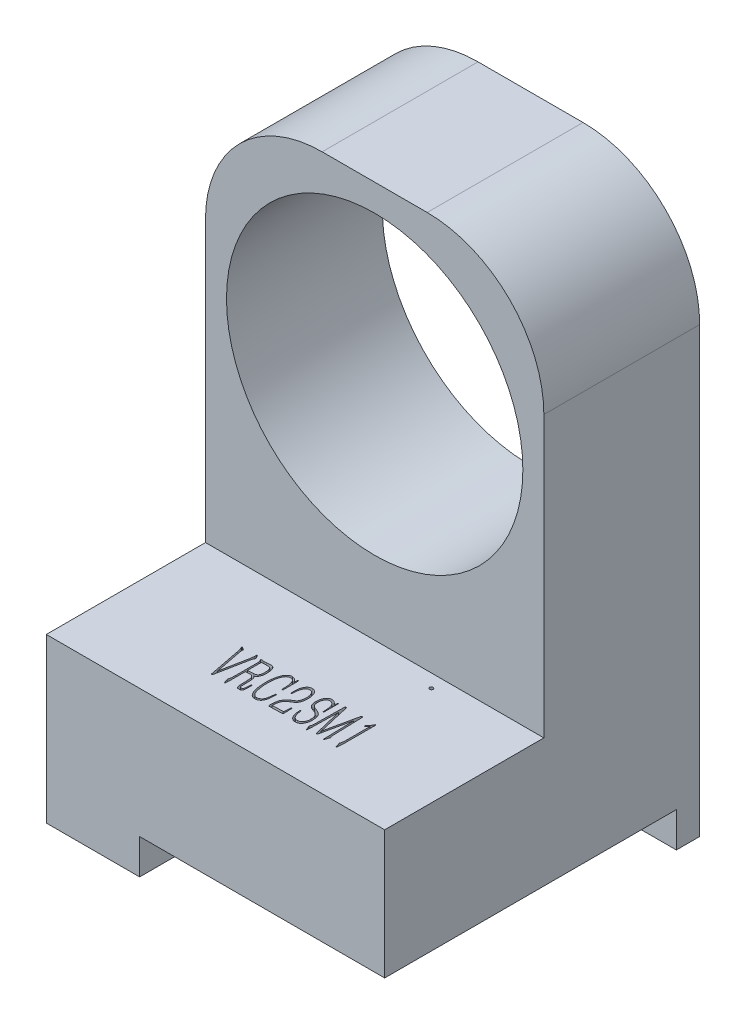
from build123d import *

# Parameters (mm, degrees)
SKETCH_1_W          = 29
SKETCH_1_H          = 29
EXTRUDE_1_DEPTH     = 5
SKETCH_2_W          = 25
SKETCH_2_H          = 25
CUT_EXTRUDE_1_DEPTH = 3
SKETCH_4_W          = 29
SKETCH_4_H          = 29
EXTRUDE_2_DEPTH     = 43
HOLE_WIZARD_M27_1_D = 25.4
CUT_EXTRUDE_START   = -15.643
SKETCH_10_R         = 18
CUT_EXTRUDE_2_DEPTH = 15.643
SKETCH_11_R         = 1
CUT_EXTRUDE_3_DEPTH = 3
CUT_EXTRUDE_4_DEPTH = 15.643
SKETCH_13_W         = 29
SKETCH_13_H         = 5
EXTRUDE_3_DEPTH     = 6
SKETCH_14_W         = 6
SKETCH_14_H         = 29
CUT_EXTRUDE_5_DEPTH = 50.794578018
SKETCH_15_W         = 29
SKETCH_15_H         = 2
CUT_EXTRUDE_6_DEPTH = 55.171025466
FILLET_1_R          = 10
CUT_EXTRUDE_7_REACH = 60.764
CUT_EXTRUDE_8_DEPTH = 0.5


with BuildPart() as part:
    # 草图1 → 凸台-拉伸1 (new body)
    with BuildSketch(Plane(origin=(0, 0, 0), x_dir=(1, 0, 0), z_dir=(0, 1, 0))):
        Rectangle(SKETCH_1_W, SKETCH_1_H)
    extrude(amount=EXTRUDE_1_DEPTH)

    # 草图2 → 切除-拉伸1 (cut)
    with BuildSketch(Plane.XZ):
        Rectangle(SKETCH_2_W, SKETCH_2_H)
    extrude(amount=-CUT_EXTRUDE_1_DEPTH, mode=Mode.SUBTRACT)

    # 草图4 → 凸台-拉伸2 (add)
    with BuildSketch(Plane(origin=(0, 5, 0), x_dir=(1, 0, 0), z_dir=(0, 1, 0))):
        with Locations((-6, 0)):
            Rectangle(SKETCH_4_W, SKETCH_4_H)
    extrude(amount=EXTRUDE_2_DEPTH)

    # 草图7 → M4 螺纹孔1 (revolve, cut)
    with BuildSketch(Plane(origin=(0, 3, 0), x_dir=(0, 0, -1), z_dir=(1, 0, 0))):
        Polygon((0, 0), (0, 11.091420021), (1.65, 10.1), (1.65, 0), align=None)
    revolve(axis=Axis((0, -3.35, 0), (0, 1, 0)), mode=Mode.SUBTRACT)

    # M27 螺纹孔1 (through all)
    with Locations(Plane(origin=(-6, 33, 14.5), x_dir=(1, 0, 0), z_dir=(0, 0, 1))):
        with Locations((0, 0)):
            Hole(HOLE_WIZARD_M27_1_D / 2)

    # 草图10 → 切除-拉伸2 (cut)
    with BuildSketch(Plane.XY.offset(14.5).offset(CUT_EXTRUDE_START)):
        with Locations((-6, 33)):
            Circle(SKETCH_10_R)
    extrude(amount=CUT_EXTRUDE_2_DEPTH, mode=Mode.SUBTRACT)

    # 草图11 → 切除-拉伸3 (cut)
    with BuildSketch(Plane(origin=(0, 0, 0), x_dir=(-1, 0, 0), z_dir=(0, -1, 0))):
        with Locations((12.5, 12.5)):
            Circle(SKETCH_11_R)
    extrude(amount=-CUT_EXTRUDE_3_DEPTH, mode=Mode.SUBTRACT)

    # 草图12 → 切除-拉伸4 (cut)
    with BuildSketch(Plane.XY.offset(14.5).offset(CUT_EXTRUDE_START)):
        with BuildLine():
            Line((-20.5, 48), (-20.5, 43.665364504))
            ThreePointArc((-20.5, 43.665364504), (-18.415569073, 46.032791128), (-15.949874371, 48))
            Line((-15.949874371, 48), (-20.5, 48))
        make_face()
        with BuildLine():
            Line((8.5, 48), (3.949874371, 48))
            ThreePointArc((3.949874371, 48), (6.415569073, 46.032791128), (8.5, 43.665364504))
            Line((8.5, 43.665364504), (8.5, 48))
        make_face()
    extrude(amount=CUT_EXTRUDE_4_DEPTH, mode=Mode.SUBTRACT)

    # 草图13 → 凸台-拉伸3 (add)
    with BuildSketch(Plane.ZY.offset(14.5)):
        with Locations((0, 2.5)):
            Rectangle(SKETCH_13_W, SKETCH_13_H)
    extrude(amount=EXTRUDE_3_DEPTH)

    # 草图14 → 切除-拉伸5 (cut, through all)
    with BuildSketch(Plane(origin=(0, 5, 0), x_dir=(1, 0, 0), z_dir=(0, 1, 0))):
        with Locations((11.5, 0)):
            Rectangle(SKETCH_14_W, SKETCH_14_H)
    extrude(amount=-CUT_EXTRUDE_5_DEPTH, mode=Mode.SUBTRACT)

    # 草图15 → 切除-拉伸6 (cut, through all)
    with BuildSketch(Plane.XZ):
        with Locations((-6, 13.5)):
            Rectangle(SKETCH_15_W, SKETCH_15_H)
    extrude(amount=-CUT_EXTRUDE_6_DEPTH, mode=Mode.SUBTRACT)

    # 圆角1
    fillet_1_edges = [part.edges().sort_by_distance(p)[0] for p in [
        (-20.5, 48, -7.8215),
        (8.5, 48, -7.8215),
    ]]
    fillet(fillet_1_edges, radius=FILLET_1_R)

    # 切除-拉伸7: up to this face of the body (flat: up to its plane)
    cut_extrude_7_end = Plane(part.part.faces().sort_by_distance((-6, 47.560682347, -1.143))[0])
    # 草图16 → 切除-拉伸7 (cut, up to the picked face)
    with BuildSketch(Plane.XY.offset(12.5), mode=Mode.PRIVATE) as cut_extrude_7_sk1:
        with BuildLine():
            Line((-20.5, 22.334635496), (-20.5, 14))
            Line((-20.5, 14), (8.5, 14))
            Line((8.5, 14), (8.5, 22.334635496))
            ThreePointArc((8.5, 22.334635496), (-6, 15), (-20.5, 22.334635496))
        make_face()
    cut_extrude_7_tool1 = split(extrude(cut_extrude_7_sk1.sketch, amount=-CUT_EXTRUDE_7_REACH, mode=Mode.PRIVATE), bisect_by=cut_extrude_7_end, keep=Keep.BOTH, mode=Mode.PRIVATE)
    add(cut_extrude_7_tool1.solids().sort_by(Axis((-20.198261, 18.167318, 12.5), (0, 0, -1)))[0], mode=Mode.SUBTRACT)

    # 草图17 → 切除-拉伸8 (cut)
    # profile 1 of 7: a face of its own
    with BuildSketch(Plane(origin=(0, 14, 0), x_dir=(1, 0, 0), z_dir=(0, 1, 0))):
        with BuildLine():
            Line((-9.956277984, -5.026142166), (-9.901089405, -5.001531043))
            Line((-9.901089405, -5.001531043), (-9.725082586, -5.313271934))
            add(Edge.make_bspline(
                [(-9.725082586, -5.313271934), (-9.734000407, -5.328453469), (-9.749914638, -5.355545566), (-9.773762803, -5.395146232), (-9.7961015, -5.439650448), (-9.815796245, -5.484696301), (-9.833181085, -5.531435513), (-9.844275475, -5.576643473), (-9.856764948, -5.628652416), (-9.862822278, -5.666225736), (-9.8660372, -5.686167736)],
                knots=[0, 0, 0, 0, 1.050845495, 1.875278674, 2.7577401, 4.020108455, 4.808513078, 5.729779683, 6.795082978, 8, 8, 8, 8], degree=3))
            Line((-9.8660372, -5.686167736), (-10.394057656, -8.368780137))
            Line((-10.394057656, -8.368780137), (-10.485044231, -8.374000679))
            Line((-10.485044231, -8.374000679), (-11.028726311, -5.580265328))
            add(Edge.make_bspline(
                [(-11.028726311, -5.580265328), (-11.031348337, -5.568304541), (-11.037057212, -5.542262604), (-11.048881015, -5.500783794), (-11.060973702, -5.452757525), (-11.076500746, -5.401535328), (-11.091288451, -5.350460428), (-11.105533834, -5.304820389), (-11.117189969, -5.26602297), (-11.131700033, -5.226255636), (-11.147457374, -5.185043301), (-11.162728404, -5.15579959), (-11.169680924, -5.142485656)],
                knots=[0, 0, 0, 0, 0.796855161, 1.734973822, 2.806513648, 4.020139396, 5.218239302, 6.267555842, 7.132481218, 7.85415497, 9.023050118, 10, 10, 10, 10], degree=3))
            Line((-11.169680924, -5.142485656), (-11.20473313, -5.076855995))
            Line((-11.20473313, -5.076855995), (-11.169680924, -5.016446875))
            Line((-11.169680924, -5.016446875), (-10.90268753, -5.207369526))
            add(Edge.make_bspline(
                [(-10.90268753, -5.207369526), (-10.906991348, -5.22644319), (-10.91509647, -5.26236348), (-10.921983084, -5.316827896), (-10.920284024, -5.374599758), (-10.913547461, -5.440096261), (-10.900610446, -5.51487532), (-10.892184583, -5.567578746), (-10.887771698, -5.59518116)],
                knots=[0, 0, 0, 0, 0.898331485, 1.691773928, 2.514283857, 3.547449524, 4.715523432, 6, 6, 6, 6], degree=3))
            Line((-10.887771698, -5.59518116), (-10.439550944, -7.875811887))
            Line((-10.439550944, -7.875811887), (-9.991330189, -5.580265328))
            add(Edge.make_bspline(
                [(-9.991330189, -5.580265328), (-9.986419053, -5.551207687), (-9.975823924, -5.488519647), (-9.965685068, -5.408302067), (-9.957837899, -5.342404413), (-9.953447855, -5.29712201), (-9.949745173, -5.258089836), (-9.947569449, -5.233970153), (-9.946582693, -5.22303115)],
                knots=[0, 0, 0, 0, 1.472770085, 3.177307748, 4.040376616, 4.789595524, 5.451045058, 6, 6, 6, 6], degree=3))
            add(Edge.make_bspline(
                [(-9.946582693, -5.22303115), (-9.946560517, -5.203132782), (-9.946517229, -5.164291579), (-9.949569064, -5.125571448), (-9.951057443, -5.106687659)],
                knots=[0, 0, 0, 0, 1.024601013, 2, 2, 2, 2], degree=3))
            Line((-9.951057443, -5.106687659), (-9.956277984, -5.026142166))
        make_face()
    # profile 2 of 7: a face of its own
    with BuildSketch(Plane(origin=(0, 14, 0), x_dir=(1, 0, 0), z_dir=(0, 1, 0))):
        with BuildLine():
            add(Edge.make_bspline(
                [(-8.492289064, -6.68254532), (-8.47735489, -6.70415802), (-8.450270488, -6.743354499), (-8.411628235, -6.799869907), (-8.381044203, -6.86021635), (-8.361771496, -6.93405542), (-8.346633561, -7.023190505), (-8.335530613, -7.126843401), (-8.326737642, -7.241494315), (-8.326234901, -7.32117246), (-8.325977536, -7.361961471)],
                knots=[0, 0, 0, 0, 0.881232765, 1.598190978, 2.295533752, 3.137383339, 4.144986829, 5.328248715, 6.632271209, 8, 8, 8, 8], degree=3))
            Line((-8.325977536, -7.361961471), (-8.311061704, -7.830318599))
            add(Edge.make_bspline(
                [(-8.311061704, -7.830318599), (-8.310573866, -7.856397367), (-8.309630415, -7.906832166), (-8.308160019, -7.977942558), (-8.300234618, -8.036537002), (-8.290532609, -8.079136905), (-8.268658458, -8.1011317), (-8.243596893, -8.111179658), (-8.209850752, -8.116224226), (-8.184297485, -8.11701129), (-8.170107091, -8.117448367)],
                knots=[0, 0, 0, 0, 1.650852431, 3.192651296, 4.477622576, 5.427192863, 5.849578153, 6.384274066, 7.102745334, 8, 8, 8, 8], degree=3))
            add(Edge.make_bspline(
                [(-8.170107091, -8.117448367), (-8.155866098, -8.118128617), (-8.129222668, -8.119401295), (-8.090418335, -8.106694055), (-8.058791589, -8.078107913), (-8.036924954, -8.034245311), (-8.020423485, -7.979952554), (-8.011202603, -7.914238775), (-8.002133471, -7.83689005), (-7.996944484, -7.780617488), (-7.994100272, -7.749773106)],
                knots=[0, 0, 0, 0, 0.741895998, 1.388010978, 2.079699508, 2.912679041, 3.92113713, 5.042206699, 6.378760387, 8, 8, 8, 8], degree=3))
            Line((-7.994100272, -7.749773106), (-7.968743358, -7.462643338))
            Line((-7.968743358, -7.462643338), (-7.903113697, -7.462643338))
            Line((-7.903113697, -7.462643338), (-7.903113697, -7.815402767))
            add(Edge.make_bspline(
                [(-7.903113697, -7.815402767), (-7.903401351, -7.848720442), (-7.903931789, -7.910158723), (-7.907586021, -7.994228985), (-7.91281996, -8.062563547), (-7.921670311, -8.116510114), (-7.933782373, -8.160390764), (-7.950989949, -8.196700853), (-7.971977802, -8.22859635), (-7.998437421, -8.253422097), (-8.026906868, -8.27409516), (-8.058093797, -8.288964083), (-8.090907169, -8.29973746), (-8.135103882, -8.305623202), (-8.185301116, -8.307007121), (-8.22381099, -8.304854645), (-8.240957293, -8.303896268)],
                knots=[0, 0, 0, 0, 1.955595562, 3.606146949, 4.93917426, 5.975540879, 6.81139212, 7.601269519, 8.32576276, 9.0378047, 9.718034635, 10.383709129, 11.057491241, 11.736467872, 12.992175141, 14, 14, 14, 14], degree=3))
            add(Edge.make_bspline(
                [(-8.240957293, -8.303896268), (-8.252980099, -8.302883719), (-8.275930229, -8.300950883), (-8.307682404, -8.290586819), (-8.335929964, -8.277338135), (-8.360509606, -8.259031455), (-8.381125039, -8.23501505), (-8.398131623, -8.205215036), (-8.41293361, -8.16985683), (-8.425789532, -8.127685867), (-8.436452029, -8.076334256), (-8.442893951, -8.013629091), (-8.449222445, -7.938810781), (-8.451038293, -7.884777881), (-8.452016318, -7.855675514)],
                knots=[0, 0, 0, 0, 0.785514098, 1.499454538, 2.167605402, 2.81714562, 3.484704239, 4.219933844, 5.049370252, 5.984178009, 7.095655963, 8.469322192, 10.098360771, 12, 12, 12, 12], degree=3))
            Line((-8.452016318, -7.855675514), (-8.457236859, -7.614039034))
            Line((-8.457236859, -7.614039034), (-8.4624574, -7.367182013))
            add(Edge.make_bspline(
                [(-8.4624574, -7.367182013), (-8.464303129, -7.334853597), (-8.468224818, -7.266164239), (-8.47710931, -7.162227313), (-8.486754067, -7.061487594), (-8.504343283, -6.972946923), (-8.530354546, -6.898152975), (-8.564700092, -6.834444441), (-8.607070143, -6.781718909), (-8.660159141, -6.745220114), (-8.722196092, -6.724842025), (-8.792892849, -6.713704311), (-8.87361971, -6.709544745), (-8.930571349, -6.71188627), (-8.960646192, -6.713122775)],
                knots=[0, 0, 0, 0, 1.186982176, 2.522024164, 3.82431485, 4.894934829, 5.823070192, 6.716229133, 7.537699214, 8.278355097, 9.042196562, 9.911176558, 10.896940655, 12, 12, 12, 12], degree=3))
            Line((-8.960646192, -6.713122775), (-9.207503213, -6.733259149))
            Line((-9.207503213, -6.733259149), (-9.207503213, -7.921305175))
            add(Edge.make_bspline(
                [(-9.207503213, -7.921305175), (-9.209688999, -7.960338604), (-9.213671249, -8.031453032), (-9.219723614, -8.127136469), (-9.224367813, -8.201473606), (-9.227915562, -8.269352307), (-9.232578451, -8.334363624), (-9.239499297, -8.389032224), (-9.24712299, -8.424586261), (-9.250805349, -8.439509904), (-9.255745086, -8.451446516), (-9.260827539, -8.449894802), (-9.262691792, -8.449325631)],
                knots=[0, 0, 0, 0, 2.178702561, 3.969346042, 5.343442504, 6.32866056, 7.759955515, 8.962971945, 9.43033784, 9.732921223, 9.902035012, 10, 10, 10, 10], degree=3))
            add(Edge.make_bspline(
                [(-9.262691792, -8.449325631), (-9.264950863, -8.448649358), (-9.2705181, -8.446982757), (-9.281530387, -8.440737251), (-9.293487006, -8.42160199), (-9.306685392, -8.393511038), (-9.31932358, -8.360890893), (-9.321961243, -8.3382779), (-9.323100912, -8.328507391)],
                knots=[0, 0, 0, 0, 0.301236197, 0.742364128, 1.580669581, 3.100179862, 4.747060191, 6, 6, 6, 6], degree=3))
            Line((-9.323100912, -8.328507391), (-9.383510032, -8.147280031))
            add(Edge.make_bspline(
                [(-9.383510032, -8.147280031), (-9.389192844, -8.130870654), (-9.399169589, -8.102062352), (-9.412421479, -8.065019957), (-9.419451041, -8.039749535), (-9.422996434, -8.019387295), (-9.414385921, -7.998804482), (-9.402002176, -7.971261147), (-9.387844441, -7.933552178), (-9.375693692, -7.888272956), (-9.365079086, -7.842272205), (-9.358157122, -7.803401432), (-9.355607432, -7.767175419), (-9.352241806, -7.726461037), (-9.350554759, -7.671216371), (-9.348566192, -7.607076413), (-9.34613535, -7.544690483), (-9.345406587, -7.494690215), (-9.343070544, -7.462658945), (-9.343198195, -7.447231261), (-9.343237285, -7.442506965)],
                knots=[0, 0, 0, 0, 1.301962309, 2.285725083, 2.940890519, 3.278257869, 3.802826989, 4.553745501, 5.567560366, 6.806006901, 8.066807115, 9.104973239, 9.759343731, 10.786589445, 12.166193442, 13.899498157, 15.595566675, 16.84419832, 17.646068083, 18, 18, 18, 18], degree=3))
            Line((-9.343237285, -7.442506965), (-9.343237285, -5.47436292))
            add(Edge.make_bspline(
                [(-9.343237285, -5.47436292), (-9.343580839, -5.459156244), (-9.344237895, -5.430073046), (-9.351562986, -5.388731264), (-9.360785227, -5.35091417), (-9.372615556, -5.329001832), (-9.37828949, -5.318492475)],
                knots=[0, 0, 0, 0, 1.127954724, 2.157245254, 3.116197974, 4, 4, 4, 4], degree=3))
            Line((-9.37828949, -5.318492475), (-9.429003319, -5.243167523))
            add(Edge.make_bspline(
                [(-9.429003319, -5.243167523), (-9.434099526, -5.234065228), (-9.443268806, -5.217688048), (-9.453913863, -5.194549491), (-9.457374421, -5.175944479), (-9.458591612, -5.160181386), (-9.447143444, -5.148757909), (-9.427818093, -5.146293851), (-9.401019396, -5.146313566), (-9.380508506, -5.150025038), (-9.3685942, -5.152180947)],
                knots=[0, 0, 0, 0, 1.380566717, 2.483966017, 3.320820912, 3.912566683, 4.446905125, 5.258929739, 6.407774973, 8, 8, 8, 8], degree=3))
            Line((-9.3685942, -5.152180947), (-9.262691792, -5.16262203))
            Line((-9.262691792, -5.16262203), (-9.156789384, -5.177537862))
            Line((-9.156789384, -5.177537862), (-8.960646192, -5.16262203))
            add(Edge.make_bspline(
                [(-8.960646192, -5.16262203), (-8.921871777, -5.160012827), (-8.85080482, -5.155230598), (-8.753557693, -5.150390686), (-8.675745363, -5.145916676), (-8.614177908, -5.142119966), (-8.562290401, -5.141700807), (-8.514122205, -5.150533703), (-8.46690838, -5.165365765), (-8.421416332, -5.187254704), (-8.378577922, -5.214530141), (-8.339491535, -5.246836388), (-8.304659371, -5.283741994), (-8.274467584, -5.3264503), (-8.247674384, -5.375740436), (-8.226707776, -5.434274448), (-8.207838193, -5.501199411), (-8.194584163, -5.577252365), (-8.183431307, -5.660598297), (-8.175218584, -5.750661913), (-8.17094314, -5.847215691), (-8.170391879, -5.913630179), (-8.170107091, -5.947940589)],
                knots=[0, 0, 0, 0, 1.680330416, 3.079761997, 4.210278293, 5.049824392, 5.748610684, 6.446652486, 7.157163236, 7.883197757, 8.622714282, 9.348032282, 10.070477093, 10.810227951, 11.603784503, 12.488235885, 13.492302087, 14.607589106, 15.822258459, 17.128285687, 18.516442711, 20, 20, 20, 20], degree=3))
            add(Edge.make_bspline(
                [(-8.170107091, -5.947940589), (-8.170380339, -5.980759187), (-8.17089194, -6.042205347), (-8.174879379, -6.127617895), (-8.182837532, -6.19988406), (-8.197305107, -6.276526551), (-8.221809561, -6.358844072), (-8.256237325, -6.446610022), (-8.294451689, -6.52285366), (-8.329906181, -6.576589373), (-8.359006878, -6.610651029), (-8.378121184, -6.630872906), (-8.397570881, -6.644589762), (-8.410899554, -6.650173191), (-8.416964112, -6.652713655)],
                knots=[0, 0, 0, 0, 1.521433389, 2.848575118, 3.962184411, 4.888901171, 6.460870269, 7.93539991, 9.254863418, 10.408771879, 10.907539274, 11.331296887, 11.695739513, 12, 12, 12, 12], degree=3))
            Line((-8.416964112, -6.652713655), (-8.492289064, -6.68254532))
        make_face()
        with BuildLine():
            Line((-9.211977963, -6.546811248), (-8.713789171, -6.526674874))
            add(Edge.make_bspline(
                [(-8.713789171, -6.526674874), (-8.693869727, -6.525512784), (-8.656110969, -6.523309956), (-8.602938621, -6.515132297), (-8.55628641, -6.50356761), (-8.504538498, -6.483028732), (-8.450443019, -6.449892802), (-8.407362163, -6.406111557), (-8.381105419, -6.364935068), (-8.365425806, -6.327817664), (-8.349932232, -6.286015309), (-8.338382157, -6.23662352), (-8.327350735, -6.178018129), (-8.320765142, -6.106651049), (-8.315387401, -6.021853606), (-8.313810648, -5.927073501), (-8.313525577, -5.830744222), (-8.31973151, -5.740882082), (-8.329259116, -5.661441381), (-8.340738702, -5.612756741), (-8.34611391, -5.589960619)],
                knots=[0, 0, 0, 0, 0.918061632, 1.740252825, 2.473002692, 3.125389995, 4.297175273, 5.365424526, 5.921000699, 6.535663214, 7.216150394, 7.97108314, 8.866688876, 9.959840128, 11.266871048, 12.777820325, 14.322752802, 15.699036693, 16.922595727, 18, 18, 18, 18], degree=3))
            add(Edge.make_bspline(
                [(-8.34611391, -5.589960619), (-8.351965504, -5.568853249), (-8.362939054, -5.5292704), (-8.387494569, -5.476852075), (-8.413333834, -5.432916691), (-8.446342891, -5.400401265), (-8.483550435, -5.375916964), (-8.526030611, -5.356981149), (-8.574992307, -5.34462828), (-8.609811028, -5.340689202), (-8.628023136, -5.338628848)],
                knots=[0, 0, 0, 0, 1.275305387, 2.391592206, 3.369358846, 4.230813774, 5.067494819, 5.95694154, 6.931367957, 8, 8, 8, 8], degree=3))
            add(Edge.make_bspline(
                [(-8.628023136, -5.338628848), (-8.633990037, -5.338590256), (-8.648662221, -5.338495362), (-8.674506932, -5.339562022), (-8.708566701, -5.340207955), (-8.750590514, -5.340741161), (-8.800543644, -5.342577598), (-8.858483101, -5.343746359), (-8.924344742, -5.346287689), (-8.971085946, -5.347621694), (-8.995698397, -5.348324139)],
                knots=[0, 0, 0, 0, 0.389305479, 0.957274318, 1.687402304, 2.612145096, 3.699440328, 4.948883328, 6.393377747, 8, 8, 8, 8], degree=3))
            Line((-8.995698397, -5.348324139), (-9.207503213, -5.358765222))
            Line((-9.207503213, -5.358765222), (-9.211977963, -6.546811248))
        make_face(mode=Mode.SUBTRACT)
    # profile 3 of 7: a face of its own
    with BuildSketch(Plane(origin=(0, 14, 0), x_dir=(1, 0, 0), z_dir=(0, 1, 0))):
        with BuildLine():
            Line((-6.346646618, -5.434090174), (-6.310848621, -5.137265115))
            Line((-6.310848621, -5.137265115), (-6.235523669, -5.137265115))
            Line((-6.235523669, -5.137265115), (-6.235523669, -6.481181586))
            Line((-6.235523669, -6.481181586), (-6.330984994, -6.481181586))
            add(Edge.make_bspline(
                [(-6.330984994, -6.481181586), (-6.331115604, -6.45681673), (-6.331388867, -6.405840359), (-6.334305222, -6.324325081), (-6.336166815, -6.231332442), (-6.339335148, -6.126429126), (-6.342312399, -6.014108915), (-6.353302449, -5.899097796), (-6.370103559, -5.782861248), (-6.39574322, -5.666268446), (-6.429459979, -5.553834993), (-6.469297632, -5.468258656), (-6.506494377, -5.408171365), (-6.536964399, -5.369110175), (-6.570927891, -5.335828264), (-6.619530565, -5.299616942), (-6.685911052, -5.263134792), (-6.744653313, -5.252801845), (-6.773985207, -5.247642273)],
                knots=[0, 0, 0, 0, 0.822473136, 1.720785642, 2.753326599, 3.962261781, 5.264018637, 6.545024146, 7.860049611, 9.226346671, 10.572050264, 11.814683136, 12.399128484, 12.954850798, 13.483022901, 13.998303406, 15.000488703, 16, 16, 16, 16], degree=3))
            add(Edge.make_bspline(
                [(-6.773985207, -5.247642273), (-6.796410768, -5.247044029), (-6.841167569, -5.245850057), (-6.907709433, -5.259306014), (-6.971810456, -5.284420068), (-7.033309713, -5.320810596), (-7.091894782, -5.367576693), (-7.143854054, -5.427403691), (-7.193261328, -5.496085486), (-7.234238285, -5.576508764), (-7.270549961, -5.662941916), (-7.304327533, -5.752869806), (-7.330525319, -5.846595956), (-7.358863153, -5.973939452), (-7.384059643, -6.131915651), (-7.402162535, -6.315808931), (-7.411624802, -6.487531445), (-7.414954852, -6.647741332), (-7.411665682, -6.801709805), (-7.406200595, -6.903312329), (-7.403433322, -6.954759255)],
                knots=[0, 0, 0, 0, 0.603095173, 1.203653813, 1.814626149, 2.451293107, 3.123130818, 3.825388984, 4.580186105, 5.398460658, 6.251023789, 7.107448911, 7.985514538, 8.871470416, 10.622993602, 12.29317529, 13.850163291, 15.257553743, 16.61134915, 18, 18, 18, 18], degree=3))
            add(Edge.make_bspline(
                [(-7.403433322, -6.954759255), (-7.399409622, -7.000767611), (-7.391176257, -7.094910697), (-7.377473028, -7.21433753), (-7.361628802, -7.315432632), (-7.345918971, -7.398740266), (-7.326336623, -7.488962083), (-7.304365075, -7.582631424), (-7.279636118, -7.672245692), (-7.25641702, -7.751713231), (-7.233012356, -7.816612773), (-7.202216541, -7.883603382), (-7.158644797, -7.953908792), (-7.102041769, -8.02968476), (-7.038569484, -8.092379436), (-6.970520653, -8.140102302), (-6.894598108, -8.167841202), (-6.841580957, -8.171005954), (-6.814257954, -8.172636945)],
                knots=[0, 0, 0, 0, 1.515526627, 3.101096572, 3.943353373, 4.87293365, 5.882541642, 6.972773351, 8.029529644, 8.932786276, 9.68898916, 10.291221641, 11.348890653, 12.39638072, 13.388602443, 14.264213047, 15.105442077, 16, 16, 16, 16], degree=3))
            add(Edge.make_bspline(
                [(-6.814257954, -8.172636945), (-6.788795165, -8.172980439), (-6.73694258, -8.17367993), (-6.659711729, -8.154038623), (-6.584741445, -8.122663069), (-6.514714078, -8.076335706), (-6.452927954, -8.014831849), (-6.400380563, -7.938302406), (-6.35871031, -7.847155692), (-6.329916186, -7.743031937), (-6.306685512, -7.630694396), (-6.291584556, -7.534830252), (-6.28089878, -7.462375734), (-6.273984685, -7.418936886), (-6.269648938, -7.386562999), (-6.267104747, -7.368920869), (-6.266101125, -7.361961471)],
                knots=[0, 0, 0, 0, 0.974493461, 1.984464659, 3.032762083, 4.086915356, 5.187622472, 6.361151533, 7.634420725, 9.018373663, 10.501751059, 12.040324543, 12.745324753, 13.31527632, 13.729892907, 14, 14, 14, 14], degree=3))
            Line((-6.266101125, -7.361961471), (-6.24074421, -7.095713869))
            Line((-6.24074421, -7.095713869), (-6.160198717, -7.100188618))
            add(Edge.make_bspline(
                [(-6.160198717, -7.100188618), (-6.160098322, -7.125049308), (-6.159915596, -7.170297279), (-6.161026156, -7.23194206), (-6.16124372, -7.280938661), (-6.163241511, -7.320940468), (-6.164538206, -7.358516369), (-6.167803283, -7.40052456), (-6.172227081, -7.450500503), (-6.18019495, -7.524259883), (-6.188216662, -7.612662219), (-6.199442206, -7.711625459), (-6.216154123, -7.808320747), (-6.247513023, -7.90924844), (-6.290683406, -8.01519994), (-6.339444836, -8.099740584), (-6.385926074, -8.162288981), (-6.426605889, -8.203961311), (-6.471745781, -8.241980196), (-6.522054952, -8.274107943), (-6.575144989, -8.301120363), (-6.630458148, -8.320284569), (-6.686538664, -8.334679381), (-6.724925011, -8.337523696), (-6.744153543, -8.338948473)],
                knots=[0, 0, 0, 0, 1.082557886, 1.97032136, 2.684891572, 3.215786613, 3.714233695, 4.322010655, 5.050226996, 5.899051791, 7.552532718, 8.915438272, 10.236158893, 11.818471953, 13.507262255, 15.209909354, 16.052150521, 16.894322113, 17.739826851, 18.616631911, 19.488074199, 20.326969254, 21.161943562, 22, 22, 22, 22], degree=3))
            add(Edge.make_bspline(
                [(-6.744153543, -8.338948473), (-6.776318384, -8.340357432), (-6.841833305, -8.343227267), (-6.938478035, -8.321190935), (-7.028876054, -8.286275731), (-7.09770804, -8.246120154), (-7.146808443, -8.20628817), (-7.181819433, -8.169646389), (-7.217202218, -8.127906702), (-7.251080927, -8.079171589), (-7.28496422, -8.024676466), (-7.316530149, -7.963593619), (-7.347109678, -7.896788916), (-7.388047328, -7.798179244), (-7.432185508, -7.661636448), (-7.467394425, -7.515918999), (-7.491074092, -7.389902897), (-7.505327093, -7.287010763), (-7.519051535, -7.178168379), (-7.53357976, -7.026582226), (-7.54555236, -6.838112407), (-7.551672785, -6.615437046), (-7.545223196, -6.394799694), (-7.52786352, -6.248401812), (-7.51903102, -6.173915445)],
                knots=[0, 0, 0, 0, 0.828879423, 1.68830212, 2.536676829, 3.328986324, 3.73541648, 4.167069034, 4.63682846, 5.148487351, 5.699502401, 6.294435402, 6.924061178, 7.598240742, 9.053084533, 10.627089957, 11.470192478, 12.366164513, 13.311378798, 14.305576584, 16.301598498, 18.191207909, 20.062109376, 22, 22, 22, 22], degree=3))
            add(Edge.make_bspline(
                [(-7.51903102, -6.173915445), (-7.508952708, -6.099345172), (-7.48889541, -5.950939553), (-7.444139981, -5.77089738), (-7.401538471, -5.635413802), (-7.368436572, -5.545069902), (-7.333287232, -5.466467798), (-7.297252095, -5.397945677), (-7.258562324, -5.338266743), (-7.217884648, -5.284664763), (-7.172462201, -5.238615546), (-7.126236021, -5.197753526), (-7.079817326, -5.164409059), (-7.037154731, -5.136743749), (-6.999579452, -5.114393848), (-6.952924229, -5.094888074), (-6.891490317, -5.079870042), (-6.840954325, -5.081313833), (-6.814257954, -5.082076536)],
                knots=[0, 0, 0, 0, 2.546659555, 5.068220541, 6.268960188, 7.35572531, 8.324149365, 9.182807276, 9.974388089, 10.730435642, 11.456747585, 12.160764052, 12.817438768, 13.389505863, 13.883390408, 14.294592413, 15.099093679, 16, 16, 16, 16], degree=3))
            add(Edge.make_bspline(
                [(-6.814257954, -5.082076536), (-6.786959124, -5.08675116), (-6.731008525, -5.096332082), (-6.649189611, -5.126348324), (-6.568387131, -5.167791664), (-6.498447019, -5.226299303), (-6.436584513, -5.286748191), (-6.405694873, -5.332406551), (-6.391394114, -5.35354468)],
                knots=[0, 0, 0, 0, 0.959137923, 1.965811105, 3.01152559, 4.09188384, 5.116612916, 6, 6, 6, 6], degree=3))
            Line((-6.391394114, -5.35354468), (-6.346646618, -5.434090174))
        make_face()
    # profile 4 of 7: a face of its own
    with BuildSketch(Plane(origin=(0, 14, 0), x_dir=(1, 0, 0), z_dir=(0, 1, 0))):
        with BuildLine():
            Line((-5.584447598, -6.385720261), (-5.660518342, -6.385720261))
            add(Edge.make_bspline(
                [(-5.660518342, -6.385720261), (-5.662085746, -6.361611006), (-5.665073877, -6.31564862), (-5.668157221, -6.250009346), (-5.669459333, -6.191073302), (-5.670763749, -6.11922336), (-5.66875201, -6.028611499), (-5.663350323, -5.95562715), (-5.660518342, -5.917363133)],
                knots=[0, 0, 0, 0, 0.927540379, 1.768282303, 2.522502339, 3.190652681, 4.527123766, 6, 6, 6, 6], degree=3))
            add(Edge.make_bspline(
                [(-5.660518342, -5.917363133), (-5.658558434, -5.888996856), (-5.654768198, -5.834139726), (-5.644765194, -5.75507722), (-5.633188688, -5.681812845), (-5.618138132, -5.61290229), (-5.597802352, -5.54546643), (-5.56885217, -5.477637575), (-5.532745838, -5.407092511), (-5.490087166, -5.336300565), (-5.443280529, -5.269502683), (-5.390742021, -5.215145434), (-5.3357562, -5.173714237), (-5.277252593, -5.149056361), (-5.221080654, -5.13372268), (-5.169856449, -5.121661105), (-5.123824869, -5.113231695), (-5.094742139, -5.112332095), (-5.081038265, -5.111908201)],
                knots=[0, 0, 0, 0, 1.238521709, 2.395159043, 3.470603583, 4.46912877, 5.466066804, 6.534123646, 7.677244524, 8.916145015, 10.13365226, 11.221244199, 12.198275335, 13.109907183, 13.966820176, 14.733954848, 15.403435577, 16, 16, 16, 16], degree=3))
            add(Edge.make_bspline(
                [(-5.081038265, -5.111908201), (-5.06357407, -5.113195883), (-5.02906536, -5.115740302), (-4.978304004, -5.127529297), (-4.929278953, -5.144527267), (-4.866574258, -5.174807288), (-4.79325121, -5.222282185), (-4.730872832, -5.284624589), (-4.687708765, -5.341690905), (-4.657303912, -5.390258753), (-4.630360415, -5.444491508), (-4.596524312, -5.523293547), (-4.561127043, -5.62786457), (-4.535600341, -5.759938496), (-4.51923325, -5.897091389), (-4.511744783, -6.03730295), (-4.510352384, -6.176132566), (-4.518504117, -6.266674991), (-4.522440353, -6.310395309)],
                knots=[0, 0, 0, 0, 0.570779476, 1.127842599, 1.694919432, 2.261066821, 3.397481896, 4.527710891, 5.118384485, 5.730727279, 6.394748858, 7.092559246, 8.529363642, 9.986910621, 11.474321506, 13.03467297, 14.568129345, 16, 16, 16, 16], degree=3))
            add(Edge.make_bspline(
                [(-4.522440353, -6.310395309), (-4.530419728, -6.355367557), (-4.546497531, -6.445983045), (-4.581127217, -6.555082844), (-4.613423325, -6.638026807), (-4.640424567, -6.693607712), (-4.669275127, -6.7428123), (-4.710992863, -6.8010016), (-4.774701296, -6.867052961), (-4.833737554, -6.911347768), (-4.8647587, -6.934622882)],
                knots=[0, 0, 0, 0, 1.490916612, 3.004077927, 3.729534125, 4.397912905, 5.020560084, 5.590839424, 6.734084393, 8, 8, 8, 8], degree=3))
            Line((-4.8647587, -6.934622882), (-5.111615721, -7.090493327))
            add(Edge.make_bspline(
                [(-5.111615721, -7.090493327), (-5.143072725, -7.111849092), (-5.202721208, -7.152343697), (-5.282368401, -7.218489731), (-5.349218902, -7.288185815), (-5.399747996, -7.365249064), (-5.438992907, -7.444574863), (-5.47384114, -7.52422572), (-5.500149784, -7.612019297), (-5.518861514, -7.690711151), (-5.531622295, -7.75680047), (-5.538014426, -7.80289257), (-5.543207167, -7.843629333), (-5.54386578, -7.869086152), (-5.544174852, -7.881032428)],
                knots=[0, 0, 0, 0, 1.453572249, 2.75625039, 3.953730064, 5.132566341, 6.263730064, 7.337486329, 8.453238547, 9.76321854, 10.430854957, 11.026567013, 11.543191201, 12, 12, 12, 12], degree=3))
            Line((-5.544174852, -7.881032428), (-5.554615934, -8.092091452))
            Line((-5.554615934, -8.092091452), (-4.653699676, -8.062259788))
            add(Edge.make_bspline(
                [(-4.653699676, -8.062259788), (-4.642139398, -8.061613423), (-4.621834957, -8.06047815), (-4.602321142, -8.039204764), (-4.597977593, -8.013229943), (-4.590270235, -7.981281661), (-4.584540342, -7.93548665), (-4.58012013, -7.900660296), (-4.577628932, -7.881032428)],
                knots=[0, 0, 0, 0, 0.925905201, 1.626257371, 2.181371879, 3.087088273, 4.358305093, 6, 6, 6, 6], degree=3))
            Line((-4.577628932, -7.881032428), (-4.557492559, -7.442506965))
            Line((-4.557492559, -7.442506965), (-4.487388148, -7.442506965))
            Line((-4.487388148, -7.442506965), (-4.462031233, -8.107007284))
            add(Edge.make_bspline(
                [(-4.462031233, -8.107007284), (-4.461183538, -8.119925895), (-4.459700918, -8.142520558), (-4.458979199, -8.172410031), (-4.458958771, -8.193222553), (-4.45927354, -8.210026554), (-4.46468573, -8.224718608), (-4.469714743, -8.241766227), (-4.489332451, -8.251397329), (-4.517531513, -8.254478858), (-4.560387818, -8.258843134), (-4.594023666, -8.258564001), (-4.613426929, -8.25840298)],
                knots=[0, 0, 0, 0, 1.385018147, 2.4223982, 3.193529914, 3.619812046, 4.200562765, 4.878496499, 5.402948042, 6.404258339, 7.925751149, 10, 10, 10, 10], degree=3))
            Line((-4.613426929, -8.25840298), (-5.615025054, -8.283759895))
            add(Edge.make_bspline(
                [(-5.615025054, -8.283759895), (-5.627200493, -8.283795513), (-5.651199183, -8.283865721), (-5.675792177, -8.260001746), (-5.686115809, -8.230787602), (-5.691282746, -8.196425907), (-5.694743683, -8.150839314), (-5.696406104, -8.072433176), (-5.692851901, -7.960873289), (-5.684846161, -7.868818864), (-5.680654715, -7.820623308)],
                knots=[0, 0, 0, 0, 0.556373901, 1.096654043, 1.476064089, 2.012759395, 2.73145082, 3.635924119, 5.715166189, 8, 8, 8, 8], degree=3))
            add(Edge.make_bspline(
                [(-5.680654715, -7.820623308), (-5.676935155, -7.792491627), (-5.669769992, -7.738300243), (-5.655201536, -7.660294514), (-5.639669201, -7.587887735), (-5.622812518, -7.521123713), (-5.604203569, -7.460354175), (-5.583891952, -7.405648692), (-5.562835832, -7.356126208), (-5.531208447, -7.300103319), (-5.491012502, -7.239036484), (-5.445291823, -7.173191736), (-5.401271713, -7.117337707), (-5.343735284, -7.055889272), (-5.265841974, -6.988817693), (-5.200406638, -6.939706221), (-5.1668043, -6.914486509)],
                knots=[0, 0, 0, 0, 1.103491021, 2.125706759, 3.085324024, 3.98349739, 4.803138144, 5.555704107, 6.252741852, 6.89323317, 8.054555834, 9.09539633, 10.010480884, 10.817709087, 12.365830683, 14, 14, 14, 14], degree=3))
            Line((-5.1668043, -6.914486509), (-4.960220025, -6.783227186))
            add(Edge.make_bspline(
                [(-4.960220025, -6.783227186), (-4.943680744, -6.772230867), (-4.911942066, -6.751129065), (-4.868104211, -6.717533284), (-4.830730795, -6.682675273), (-4.798523604, -6.645058926), (-4.76936805, -6.601531478), (-4.74542374, -6.547275196), (-4.720110262, -6.483366519), (-4.690596152, -6.38393656), (-4.660164972, -6.252697757), (-4.648499355, -6.090547046), (-4.654731233, -5.92629345), (-4.673783257, -5.817273436), (-4.68353134, -5.761492688)],
                knots=[0, 0, 0, 0, 0.635613896, 1.219735276, 1.765761318, 2.268061313, 2.802129131, 3.435697723, 4.161225462, 5.001884758, 6.75303811, 8.46119913, 10.189351173, 12, 12, 12, 12], degree=3))
            add(Edge.make_bspline(
                [(-4.68353134, -5.761492688), (-4.690876686, -5.733055688), (-4.705202549, -5.677594093), (-4.732317289, -5.597699505), (-4.76741566, -5.524933435), (-4.804983176, -5.45695875), (-4.852048174, -5.397457416), (-4.914739459, -5.354723622), (-4.988800706, -5.326157066), (-5.042974642, -5.321126661), (-5.071342974, -5.318492475)],
                knots=[0, 0, 0, 0, 1.101106684, 2.147523679, 3.156537618, 4.125318695, 5.058520457, 5.968677808, 6.93629249, 8, 8, 8, 8], degree=3))
            add(Edge.make_bspline(
                [(-5.071342974, -5.318492475), (-5.08627537, -5.318339598), (-5.116059081, -5.318034675), (-5.160420603, -5.324761977), (-5.203568295, -5.338867295), (-5.260246712, -5.364432401), (-5.325739761, -5.412053275), (-5.394676123, -5.48390415), (-5.451537659, -5.571635632), (-5.495316688, -5.673300418), (-5.528235257, -5.789124324), (-5.554958692, -5.918931458), (-5.572506069, -6.064367929), (-5.577408507, -6.16616253), (-5.579972849, -6.219408733)],
                knots=[0, 0, 0, 0, 0.469335518, 0.936122588, 1.403629858, 1.893624907, 2.887406355, 3.927357629, 5.011993806, 6.157121359, 7.396943717, 8.794309501, 10.323183677, 12, 12, 12, 12], degree=3))
            Line((-5.579972849, -6.219408733), (-5.584447598, -6.385720261))
        make_face()
    # profile 5 of 7: a face of its own
    with BuildSketch(Plane(origin=(0, 14, 0), x_dir=(1, 0, 0), z_dir=(0, 1, 0))):
        with BuildLine():
            Line((-2.94061636, -5.419174342), (-2.889902531, -5.111908201))
            Line((-2.889902531, -5.111908201), (-2.839934494, -5.117128742))
            Line((-2.839934494, -5.117128742), (-2.839934494, -6.375279179))
            Line((-2.839934494, -6.375279179), (-2.900343614, -6.38049972))
            Line((-2.900343614, -6.38049972), (-2.935395819, -5.847258723))
            add(Edge.make_bspline(
                [(-2.935395819, -5.847258723), (-2.940010938, -5.817606529), (-2.94854213, -5.76279352), (-2.965265078, -5.68856439), (-2.980775646, -5.627820095), (-3.004810029, -5.566261188), (-3.040475724, -5.500539052), (-3.093011127, -5.430095261), (-3.156044183, -5.366639792), (-3.230793998, -5.316723429), (-3.311812056, -5.278573126), (-3.370060668, -5.271322654), (-3.398532405, -5.267778646)],
                knots=[0, 0, 0, 0, 1.116474761, 2.063838624, 2.831507158, 3.446633667, 4.518832044, 5.603216916, 6.708904972, 7.82779241, 8.938231816, 10, 10, 10, 10], degree=3))
            add(Edge.make_bspline(
                [(-3.398532405, -5.267778646), (-3.41549568, -5.268505756), (-3.450323271, -5.269998599), (-3.494041422, -5.280280569), (-3.531299847, -5.293917004), (-3.562112721, -5.311460687), (-3.596004275, -5.334957198), (-3.631408477, -5.364125932), (-3.667007901, -5.397455863), (-3.698581226, -5.436190295), (-3.7262984, -5.478606174), (-3.756020037, -5.539746271), (-3.785616236, -5.617673011), (-3.805181374, -5.698384389), (-3.813733321, -5.765854535), (-3.818986342, -5.822818062), (-3.822359578, -5.886752243), (-3.825319, -5.955883115), (-3.822775612, -6.027104771), (-3.812513156, -6.096753141), (-3.794036786, -6.163018879), (-3.775436076, -6.204198661), (-3.766207666, -6.224629274)],
                knots=[0, 0, 0, 0, 0.864038106, 1.773971445, 2.275285977, 2.88209936, 3.574564674, 4.376127188, 5.218616224, 6.055847121, 6.916999662, 7.795414815, 9.515900782, 11.157236165, 12.013901558, 12.981067707, 14.072720019, 15.277182195, 16.507433409, 17.699229733, 18.858513907, 20, 20, 20, 20], degree=3))
            add(Edge.make_bspline(
                [(-3.766207666, -6.224629274), (-3.755759203, -6.243574903), (-3.7353831, -6.280521777), (-3.69727498, -6.329711023), (-3.652520634, -6.369577705), (-3.589658047, -6.410195032), (-3.514253006, -6.44649627), (-3.454816491, -6.470499062), (-3.42836407, -6.481181586)],
                knots=[0, 0, 0, 0, 0.892298636, 1.740118821, 2.553971753, 3.353728668, 4.822268012, 6, 6, 6, 6], degree=3))
            Line((-3.42836407, -6.481181586), (-3.252357251, -6.552031789))
            add(Edge.make_bspline(
                [(-3.252357251, -6.552031789), (-3.230642441, -6.562046282), (-3.188831956, -6.581328552), (-3.129903933, -6.612003927), (-3.076552599, -6.642337804), (-3.015166791, -6.683423303), (-2.947526957, -6.737384427), (-2.880691345, -6.8118045), (-2.826381091, -6.896143537), (-2.792314326, -6.994481659), (-2.765482933, -7.101162067), (-2.747366097, -7.217055083), (-2.735404744, -7.343580744), (-2.730597, -7.478947312), (-2.732726234, -7.618832025), (-2.75060766, -7.710149029), (-2.759389, -7.754993647)],
                knots=[0, 0, 0, 0, 0.703245545, 1.354054533, 1.953549274, 2.507188807, 3.525842386, 4.488918984, 5.43838142, 6.454223102, 7.53246407, 8.673253088, 9.899948524, 11.268249991, 12.658472344, 14, 14, 14, 14], degree=3))
            add(Edge.make_bspline(
                [(-2.759389, -7.754993647), (-2.770368417, -7.799967035), (-2.79163488, -7.887077758), (-2.837645425, -7.987161399), (-2.877976625, -8.057934181), (-2.907854905, -8.103799986), (-2.937731309, -8.143215433), (-2.976777669, -8.189472008), (-3.036998137, -8.23823292), (-3.107257171, -8.277061596), (-3.171930321, -8.301202156), (-3.225611366, -8.315003467), (-3.283247838, -8.321998902), (-3.32294316, -8.323342252), (-3.343343827, -8.324032641)],
                knots=[0, 0, 0, 0, 1.868422262, 3.619020558, 4.429541533, 5.162879566, 5.830420081, 6.429075538, 7.606854402, 8.938752151, 9.657684361, 10.394048182, 11.174651193, 12, 12, 12, 12], degree=3))
            add(Edge.make_bspline(
                [(-3.343343827, -8.324032641), (-3.366252779, -8.323886907), (-3.411092677, -8.32360166), (-3.476696442, -8.312990815), (-3.538604478, -8.293570238), (-3.596254471, -8.264694366), (-3.650171988, -8.228628345), (-3.70024736, -8.185845897), (-3.746559343, -8.136798486), (-3.790291423, -8.082434889), (-3.828597231, -8.021048785), (-3.863210364, -7.954285482), (-3.892816031, -7.881801626), (-3.926008564, -7.779502616), (-3.955175899, -7.649546632), (-3.963518568, -7.544333068), (-3.9675714, -7.493220794)],
                knots=[0, 0, 0, 0, 0.833862414, 1.63212638, 2.411403016, 3.189256699, 3.973153178, 4.770028097, 5.583768076, 6.428386665, 7.307987397, 8.215552436, 9.166047206, 10.157242313, 12.13320567, 14, 14, 14, 14], degree=3))
            Line((-3.9675714, -7.493220794), (-3.987707773, -7.226227399))
            Line((-3.987707773, -7.226227399), (-3.91685757, -7.226227399))
            add(Edge.make_bspline(
                [(-3.91685757, -7.226227399), (-3.912782047, -7.257820594), (-3.904941316, -7.318601428), (-3.891164559, -7.406278658), (-3.877885503, -7.487100111), (-3.860911089, -7.583689065), (-3.834356324, -7.692796925), (-3.792522061, -7.81137082), (-3.737892873, -7.915429025), (-3.679527803, -7.988526803), (-3.629335735, -8.03938197), (-3.589321899, -8.068578959), (-3.550343428, -8.093801052), (-3.497516347, -8.115373587), (-3.431693781, -8.13261024), (-3.378753054, -8.132444635), (-3.353039117, -8.132364199)],
                knots=[0, 0, 0, 0, 1.134650933, 2.182907786, 3.161205505, 4.052250561, 5.675932663, 7.155002512, 8.52184542, 9.839854562, 10.472309825, 11.060302883, 11.600982628, 12.120735338, 13.087218943, 14, 14, 14, 14], degree=3))
            add(Edge.make_bspline(
                [(-3.353039117, -8.132364199), (-3.330342194, -8.131552921), (-3.286803454, -8.129996676), (-3.224540648, -8.116781473), (-3.167822937, -8.096529334), (-3.117848333, -8.065444787), (-3.073030543, -8.027924259), (-3.032590514, -7.984040314), (-2.995527215, -7.934612398), (-2.96461997, -7.879121965), (-2.937334005, -7.821762311), (-2.914907854, -7.764751952), (-2.898272554, -7.709088207), (-2.886994359, -7.654140222), (-2.879344885, -7.597318062), (-2.87544667, -7.536783086), (-2.872603763, -7.471106058), (-2.874169542, -7.425851759), (-2.874986699, -7.402234218)],
                knots=[0, 0, 0, 0, 1.108065456, 2.12556444, 3.098260599, 4.035950869, 4.98490885, 5.94776606, 6.946521194, 7.996930623, 9.045863326, 10.049925535, 10.987930625, 11.881525266, 12.788809675, 13.787786499, 14.845478855, 16, 16, 16, 16], degree=3))
            add(Edge.make_bspline(
                [(-2.874986699, -7.402234218), (-2.877597675, -7.365372553), (-2.882470865, -7.29657305), (-2.898273482, -7.201881567), (-2.917563833, -7.122344771), (-2.943305217, -7.056968618), (-2.974578568, -7.002918317), (-3.007445889, -6.954335957), (-3.044491061, -6.91101567), (-3.086700108, -6.873278463), (-3.133072125, -6.83829553), (-3.185284717, -6.805763961), (-3.243765113, -6.774861421), (-3.285764198, -6.757288616), (-3.30754583, -6.748174981)],
                knots=[0, 0, 0, 0, 1.578487453, 2.946127177, 4.097996722, 5.070650713, 5.936469873, 6.761635482, 7.575228913, 8.364955199, 9.176673428, 10.055112166, 10.991339211, 12, 12, 12, 12], degree=3))
            Line((-3.30754583, -6.748174981), (-3.524571187, -6.667629488))
            add(Edge.make_bspline(
                [(-3.524571187, -6.667629488), (-3.558342164, -6.652866952), (-3.625262275, -6.623613712), (-3.716602555, -6.564449386), (-3.796193317, -6.492827907), (-3.860285631, -6.405889771), (-3.909503259, -6.304666588), (-3.939572319, -6.209833551), (-3.956320457, -6.124633246), (-3.963772013, -6.052010097), (-3.968667245, -5.972120198), (-3.967948311, -5.916625424), (-3.9675714, -5.887531469)],
                knots=[0, 0, 0, 0, 1.141640751, 2.262259852, 3.359181592, 4.444772656, 5.58953336, 6.835542724, 7.519006772, 8.279340868, 9.097919025, 10, 10, 10, 10], degree=3))
            add(Edge.make_bspline(
                [(-3.9675714, -5.887531469), (-3.967358858, -5.862414025), (-3.966947995, -5.813859816), (-3.961726131, -5.74361756), (-3.95285336, -5.678879845), (-3.936955344, -5.599846304), (-3.90850668, -5.507031882), (-3.864314309, -5.403127628), (-3.813103581, -5.310318777), (-3.754230644, -5.2324918), (-3.687016253, -5.171642), (-3.625821985, -5.129517074), (-3.570232043, -5.104498051), (-3.522564606, -5.090970491), (-3.469582812, -5.084082517), (-3.432607286, -5.082761189), (-3.413448237, -5.082076536)],
                knots=[0, 0, 0, 0, 0.971164436, 1.877345498, 2.721647718, 3.496542433, 4.992871533, 6.466013358, 7.856401207, 9.083219229, 10.219456221, 11.349985082, 11.939558551, 12.569451447, 13.258754286, 14, 14, 14, 14], degree=3))
            add(Edge.make_bspline(
                [(-3.413448237, -5.082076536), (-3.391974047, -5.084519385), (-3.349264809, -5.089377879), (-3.28662057, -5.106356065), (-3.226019488, -5.130733832), (-3.169423524, -5.163827064), (-3.117372809, -5.200675558), (-3.070538379, -5.238922622), (-3.032259674, -5.280305256), (-3.011194437, -5.309580695), (-3.00102548, -5.323713016)],
                knots=[0, 0, 0, 0, 1.049956055, 2.088219507, 3.145806661, 4.218152357, 5.268178035, 6.24663062, 7.15358473, 8, 8, 8, 8], degree=3))
            Line((-3.00102548, -5.323713016), (-2.94061636, -5.419174342))
        make_face()
    # profile 6 of 7: a face of its own
    with BuildSketch(Plane(origin=(0, 14, 0), x_dir=(1, 0, 0), z_dir=(0, 1, 0))):
        with BuildLine():
            Line((-0.919521112, -5.056719622), (-0.803923413, -5.056719622))
            Line((-0.803923413, -5.056719622), (-0.733819002, -7.417895842))
            Line((-0.733819002, -7.417895842), (-0.728598461, -7.639395948))
            add(Edge.make_bspline(
                [(-0.728598461, -7.639395948), (-0.728343552, -7.664008819), (-0.72791055, -7.705817587), (-0.724512167, -7.761949712), (-0.716791763, -7.808705842), (-0.706954686, -7.853159327), (-0.693927033, -7.895384974), (-0.680444115, -7.931658241), (-0.666694205, -7.95819933), (-0.65941263, -7.979237939), (-0.662858863, -7.999366176), (-0.668740205, -8.024922086), (-0.68251782, -8.061742268), (-0.69239494, -8.090580729), (-0.698021005, -8.107007284)],
                knots=[0, 0, 0, 0, 1.833532234, 3.114538037, 4.183068399, 5.360011406, 6.502211209, 7.47535404, 8.229329157, 8.745810393, 9.081162989, 9.727925243, 10.705812996, 12, 12, 12, 12], degree=3))
            Line((-0.698021005, -8.107007284), (-0.753955376, -8.278539353))
            add(Edge.make_bspline(
                [(-0.753955376, -8.278539353), (-0.760102715, -8.294227059), (-0.770966286, -8.321950352), (-0.785855284, -8.35753703), (-0.796315177, -8.3819026), (-0.806163828, -8.397521147), (-0.816693684, -8.405757794), (-0.829360367, -8.408610479), (-0.839067686, -8.400296842), (-0.842325082, -8.393068523), (-0.84419616, -8.388916511)],
                knots=[0, 0, 0, 0, 2.257142557, 3.988819353, 5.165733309, 5.812331029, 6.431774305, 6.935717094, 7.388666149, 8, 8, 8, 8], degree=3))
            add(Edge.make_bspline(
                [(-0.84419616, -8.388916511), (-0.847340915, -8.382814632), (-0.855343333, -8.367287258), (-0.855406248, -8.334516334), (-0.855341967, -8.290695046), (-0.851553353, -8.257172309), (-0.849416701, -8.238266607)],
                knots=[0, 0, 0, 0, 0.533370556, 1.357261302, 2.50958371, 4, 4, 4, 4], degree=3))
            Line((-0.849416701, -8.238266607), (-0.859111992, -7.921305175))
            Line((-0.859111992, -7.921305175), (-0.919521112, -5.741356315))
            Line((-0.919521112, -5.741356315), (-1.483339565, -8.298675727))
            Line((-1.483339565, -8.298675727), (-1.579546682, -8.293455185))
            Line((-1.579546682, -8.293455185), (-2.188112631, -5.771187979))
            Line((-2.188112631, -5.771187979), (-2.228385378, -7.945916298))
            Line((-2.228385378, -7.945916298), (-2.23882646, -8.25840298))
            add(Edge.make_bspline(
                [(-2.23882646, -8.25840298), (-2.238948778, -8.281088574), (-2.239167616, -8.321675357), (-2.246399232, -8.368263152), (-2.253535273, -8.397187595), (-2.25902103, -8.410225921), (-2.265381346, -8.419884664), (-2.271221745, -8.419616129), (-2.273878666, -8.419493967)],
                knots=[0, 0, 0, 0, 2.35867652, 4.21990684, 4.917432392, 5.427710553, 5.739653463, 6, 6, 6, 6], degree=3))
            add(Edge.make_bspline(
                [(-2.273878666, -8.419493967), (-2.277377672, -8.418895643), (-2.284701849, -8.417643223), (-2.298465958, -8.411439166), (-2.308905658, -8.388039421), (-2.317661853, -8.36236085), (-2.325682537, -8.337286981), (-2.329830328, -8.321250028), (-2.333447342, -8.310995729), (-2.334080735, -8.30564528), (-2.334287786, -8.303896268)],
                knots=[0, 0, 0, 0, 0.61831469, 1.294266409, 2.516485019, 4.811391437, 6.122679461, 7.065853468, 7.69463614, 8, 8, 8, 8], degree=3))
            Line((-2.334287786, -8.303896268), (-2.425274361, -8.07717562))
            add(Edge.make_bspline(
                [(-2.425274361, -8.07717562), (-2.427730595, -8.065800779), (-2.432554718, -8.043460228), (-2.431654943, -8.008044253), (-2.422126273, -7.970625395), (-2.407918651, -7.931694261), (-2.393463382, -7.896042771), (-2.383194211, -7.869881996), (-2.37736278, -7.849951193), (-2.375143195, -7.829827799), (-2.371748156, -7.803552057), (-2.370112223, -7.772637996), (-2.368252037, -7.741787237), (-2.365569742, -7.715242529), (-2.364544363, -7.695290654), (-2.362750272, -7.681422087), (-2.361654205, -7.669492213), (-2.361007286, -7.655310508), (-2.360478316, -7.63490668), (-2.358437048, -7.608348905), (-2.358442791, -7.575489022), (-2.356210651, -7.536745138), (-2.356144714, -7.491717521), (-2.355023797, -7.459657558), (-2.354424159, -7.442506965)],
                knots=[0, 0, 0, 0, 1.187984124, 2.333238898, 3.586201942, 5.123185855, 6.573707022, 7.523685523, 7.99901539, 8.693496643, 9.589827362, 10.711954829, 11.85946849, 12.753267707, 13.442133117, 13.902940376, 14.183976602, 14.668078378, 15.355532658, 16.272922794, 17.392740166, 18.716797284, 20.243638767, 22, 22, 22, 22], degree=3))
            Line((-2.354424159, -7.442506965), (-2.319371954, -5.056719622))
            Line((-2.319371954, -5.056719622), (-2.198553714, -5.056719622))
            Line((-2.198553714, -5.056719622), (-1.539273935, -7.905643551))
            Line((-1.539273935, -7.905643551), (-0.919521112, -5.056719622))
        make_face()
    # profile 7 of 7: a face of its own
    with BuildSketch(Plane(origin=(0, 14, 0), x_dir=(1, 0, 0), z_dir=(0, 1, 0))):
        with BuildLine():
            Line((0.299848161, -5.086551286), (0.35503674, -5.086551286))
            Line((0.35503674, -5.086551286), (0.349816199, -7.760214188))
            add(Edge.make_bspline(
                [(0.349816199, -7.760214188), (0.349221481, -7.784326477), (0.348081177, -7.830559108), (0.347988632, -7.896706011), (0.34581322, -7.956595898), (0.345639948, -8.010314512), (0.344022347, -8.057791676), (0.342151747, -8.099037325), (0.341974004, -8.134128774), (0.338665247, -8.18905142), (0.334722425, -8.264565963), (0.324944429, -8.342344659), (0.31716041, -8.397765234), (0.309247312, -8.422993649), (0.299222229, -8.442955197), (0.289217217, -8.440627312), (0.284932329, -8.43963034)],
                knots=[0, 0, 0, 0, 1.45038606, 2.780953852, 3.977268029, 5.053718292, 6.010937745, 6.833690271, 7.536464333, 8.120251454, 10.142880859, 12.069479857, 12.873132744, 13.440417135, 13.76034519, 14, 14, 14, 14], degree=3))
            add(Edge.make_bspline(
                [(0.284932329, -8.43963034), (0.2839418, -8.438880577), (0.279702093, -8.43567141), (0.269591566, -8.428878782), (0.257578174, -8.410670743), (0.252319463, -8.394335685), (0.249134332, -8.384441761)],
                knots=[0, 0, 0, 0, 0.221265066, 0.947068446, 2.150880552, 4, 4, 4, 4], degree=3))
            Line((0.249134332, -8.384441761), (0.224523209, -8.3188121))
            Line((0.224523209, -8.3188121), (0.168588839, -8.13758474))
            add(Edge.make_bspline(
                [(0.168588839, -8.13758474), (0.161855547, -8.120533113), (0.150126501, -8.090830058), (0.138294481, -8.051751564), (0.129318312, -8.026798296), (0.126932519, -8.006572586), (0.138424896, -7.987600817), (0.146888638, -7.958390076), (0.159912076, -7.921104489), (0.172210661, -7.877097392), (0.183073213, -7.829548418), (0.192858478, -7.778173247), (0.198404068, -7.720290514), (0.201124396, -7.665024655), (0.203212086, -7.611815221), (0.203591387, -7.560589357), (0.20463755, -7.499936368), (0.20447412, -7.456180484), (0.204386836, -7.432811674)],
                knots=[0, 0, 0, 0, 1.220359697, 2.125803599, 2.712350858, 2.994193817, 3.439826662, 4.12562012, 5.031064022, 6.063176816, 7.167225426, 8.277459231, 9.542238136, 11.034069985, 11.961482632, 13.08703073, 14.444263491, 16, 16, 16, 16], degree=3))
            Line((0.204386836, -7.432811674), (0.208861586, -5.459447088))
            Line((0.208861586, -5.459447088), (-0.052911267, -5.686167736))
            Line((-0.052911267, -5.686167736), (-0.073047641, -5.600401702))
            add(Edge.make_bspline(
                [(-0.073047641, -5.600401702), (-0.051769202, -5.578414582), (-0.011881891, -5.537198821), (0.041425238, -5.477855532), (0.085268486, -5.426354956), (0.130934154, -5.366148371), (0.18206208, -5.29122165), (0.21981844, -5.22966367), (0.239439041, -5.197674235)],
                knots=[0, 0, 0, 0, 1.077185482, 2.019228619, 2.808185376, 3.45765616, 4.678836699, 6, 6, 6, 6], degree=3))
            Line((0.239439041, -5.197674235), (0.299848161, -5.086551286))
        make_face()
    extrude(amount=-CUT_EXTRUDE_8_DEPTH, mode=Mode.SUBTRACT)


solid = part.part
